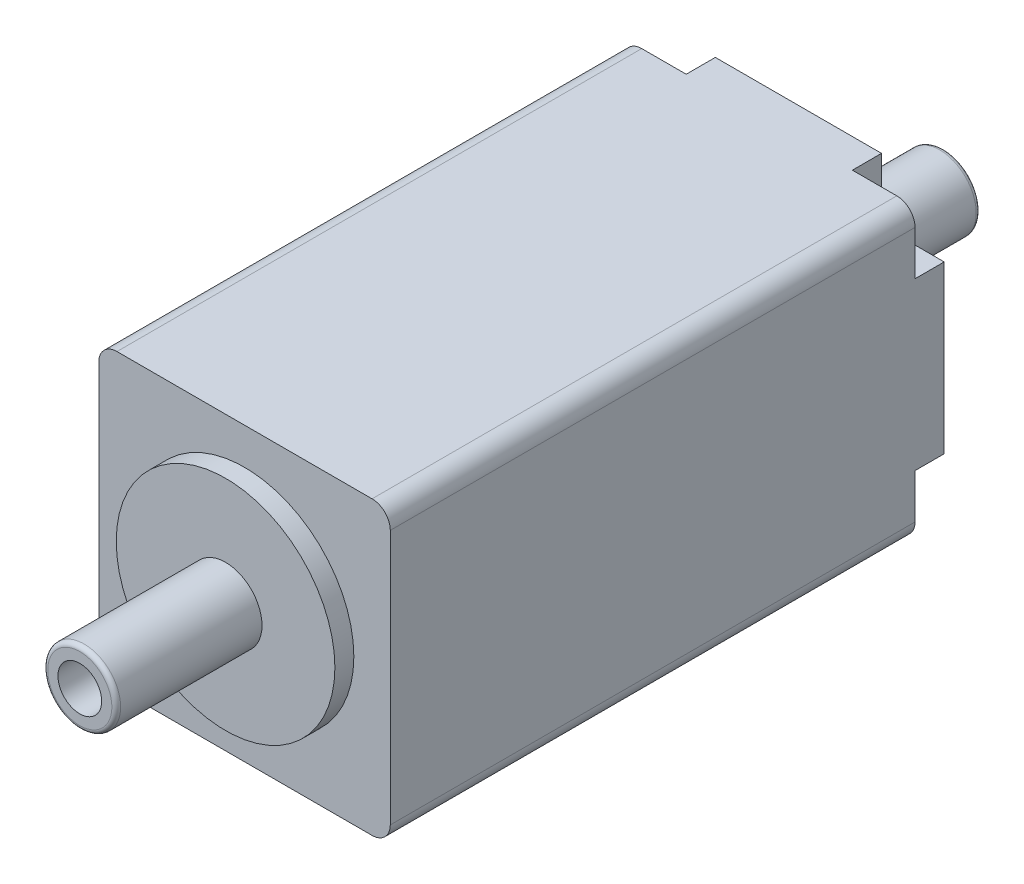
from build123d import *

# Parameters (mm, degrees)
SKETCH1_R           = 1.5
BOSS_EXTRUDE1_DEPTH = 38
BOSS_EXTRUDE2_START = 1.3
SKETCH3_R           = 7.5
SKETCH3_R_2         = 1.5
BOSS_EXTRUDE2_DEPTH = 1.3
CUT_EXTRUDE1_DEPTH  = 2
SKETCH5_R           = 1.05
CUT_EXTRUDE2_DEPTH  = 4
BOSS_EXTRUDE3_START = 10
SKETCH6_R           = 2.5
SKETCH6_R_2         = 1.5
BOSS_EXTRUDE3_DEPTH = 10
SKETCH7_R           = 2.5
SKETCH7_R_2         = 1.5
BOSS_EXTRUDE4_DEPTH = 10
FILLET1_R           = 0.3


with BuildPart() as part:
    # Sketch1 → Boss-Extrude1 (new body)
    with BuildSketch(Plane(origin=(0, 0, 0), x_dir=(0, 1, 0), z_dir=(0, 0, 1))):
        with BuildLine():
            Line((-8.75, -10), (8.75, -10))
            ThreePointArc((8.75, -10), (9.633883476, -9.633883476), (10, -8.75))
            Line((10, -8.75), (10, 8.75))
            ThreePointArc((10, 8.75), (9.633883476, 9.633883476), (8.75, 10))
            Line((8.75, 10), (-8.75, 10))
            ThreePointArc((-8.75, 10), (-9.633883476, 9.633883476), (-10, 8.75))
            Line((-10, 8.75), (-10, -8.75))
            ThreePointArc((-10, -8.75), (-9.633883476, -9.633883476), (-8.75, -10))
        make_face()
        with Locations(Location((0, 0, 0), (0, 0, 270))):
            Circle(SKETCH1_R, mode=Mode.SUBTRACT)
    extrude(amount=-BOSS_EXTRUDE1_DEPTH)

    # Sketch3 → Boss-Extrude2 (add)
    with BuildSketch(Plane.XY.offset(BOSS_EXTRUDE2_START)):
        Circle(SKETCH3_R)
        Circle(SKETCH3_R_2, mode=Mode.SUBTRACT)
    extrude(amount=-BOSS_EXTRUDE2_DEPTH)

    # Sketch4 → Cut-Extrude1 (cut)
    with BuildSketch(Plane(origin=(0, 0, -38), x_dir=(1, 0, 0), z_dir=(0, 0, -1))):
        with BuildLine():
            Line((-10, 5.7), (-10, 10))
            Line((-10, 10), (-5.7, 10))
            Line((-5.7, 10), (-5.7, 7.2))
            ThreePointArc((-5.7, 7.2), (-6.139339828, 6.139339828), (-7.2, 5.7))
            Line((-7.2, 5.7), (-10, 5.7))
        make_face()
        with BuildLine():
            Line((7.2, 5.7), (10, 5.7))
            Line((10, 5.7), (10, 10))
            Line((10, 10), (5.7, 10))
            Line((5.7, 10), (5.7, 7.2))
            ThreePointArc((5.7, 7.2), (6.139339828, 6.139339828), (7.2, 5.7))
        make_face()
        with BuildLine():
            Line((5.7, -7.2), (5.7, -10))
            Line((5.7, -10), (10, -10))
            Line((10, -10), (10, -5.7))
            Line((10, -5.7), (7.2, -5.7))
            ThreePointArc((7.2, -5.7), (6.139339828, -6.139339828), (5.7, -7.2))
        make_face()
        with BuildLine():
            Line((-7.2, -5.7), (-10, -5.7))
            Line((-10, -5.7), (-10, -10))
            Line((-10, -10), (-5.7, -10))
            Line((-5.7, -10), (-5.7, -7.2))
            ThreePointArc((-5.7, -7.2), (-6.139339828, -6.139339828), (-7.2, -5.7))
        make_face()
    extrude(amount=-CUT_EXTRUDE1_DEPTH, mode=Mode.SUBTRACT)

    # Sketch5 → Cut-Extrude2 (cut)
    with BuildSketch(Plane(origin=(0, 0, -36), x_dir=(1, 0, 0), z_dir=(0, 0, -1))):
        with BuildLine():
            ThreePointArc((6.65, 7.7), (6.95753788, 6.95753788), (7.7, 6.65))
            Line((7.7, 6.65), (7.7, 7.7))
            Line((7.7, 7.7), (6.65, 7.7))
        make_face()
        with BuildLine():
            Line((7.7, 7.7), (7.7, 6.65))
            ThreePointArc((7.7, 6.65), (8.44246212, 6.95753788), (8.75, 7.7))
            ThreePointArc((8.75, 7.7), (7.7, 8.75), (6.65, 7.7))
            Line((6.65, 7.7), (7.7, 7.7))
        make_face()
        with BuildLine():
            Line((-7.7, -6.65), (-7.7, -7.7))
            Line((-7.7, -7.7), (-6.65, -7.7))
            ThreePointArc((-6.65, -7.7), (-6.95753788, -6.95753788), (-7.7, -6.65))
        make_face()
        with BuildLine():
            Line((-6.65, -7.7), (-7.7, -7.7))
            Line((-7.7, -7.7), (-7.7, -6.65))
            ThreePointArc((-7.7, -6.65), (-8.44246212, -8.44246212), (-6.65, -7.7))
        make_face()
        with BuildLine():
            ThreePointArc((-6.65, 7.7), (-8.44246212, 8.44246212), (-7.7, 6.65))
            Line((-7.7, 6.65), (-7.7, 7.7))
            Line((-7.7, 7.7), (-6.65, 7.7))
        make_face()
        with BuildLine():
            Line((-7.7, 7.7), (-7.7, 6.65))
            ThreePointArc((-7.7, 6.65), (-6.95753788, 6.95753788), (-6.65, 7.7))
            Line((-6.65, 7.7), (-7.7, 7.7))
        make_face()
        with Locations(Location((7.7, -7.7, 0), (0, 0, 180))):
            Circle(SKETCH5_R)
    extrude(amount=-CUT_EXTRUDE2_DEPTH, mode=Mode.SUBTRACT)

    # Sketch6 → Boss-Extrude3 (add)
    with BuildSketch(Plane.XY.offset(1.3).offset(BOSS_EXTRUDE3_START)):
        Circle(SKETCH6_R)
        Circle(SKETCH6_R_2, mode=Mode.SUBTRACT)
    extrude(amount=-BOSS_EXTRUDE3_DEPTH)

    # Sketch7 → Boss-Extrude4 (add)
    with BuildSketch(Plane(origin=(0, 0, -38), x_dir=(1, 0, 0), z_dir=(0, 0, -1))):
        Circle(SKETCH7_R)
        Circle(SKETCH7_R_2, mode=Mode.SUBTRACT)
    extrude(amount=BOSS_EXTRUDE4_DEPTH)

    # Fillet1
    fillet1_edges = [part.edges().sort_by_distance(p)[0] for p in [
        (-2.5, 0, 11.3),
        (-2.5, 0, -48),
    ]]
    fillet(fillet1_edges, radius=FILLET1_R)


solid = part.part
